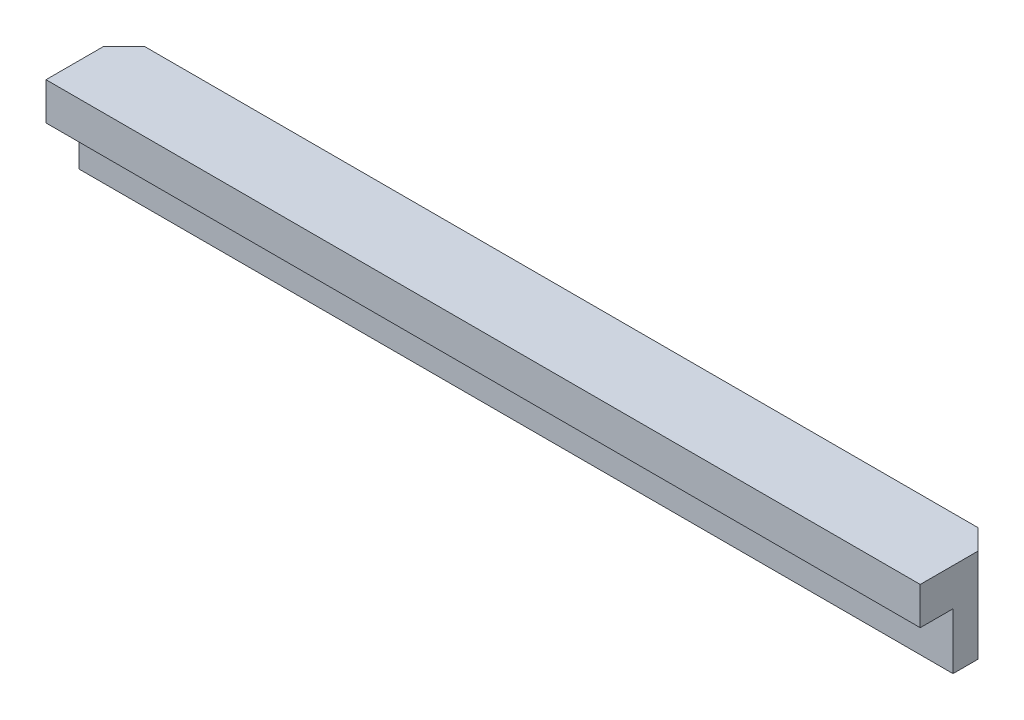
from build123d import *

# Parameters (mm, degrees)
SKETCH1_W           = 280
SKETCH1_H           = 25
BOSS_EXTRUDE1_DEPTH = 30
SKETCH2_W           = 10.5
SKETCH2_H           = 18
CUT_EXTRUDE1_DEPTH  = 300
CHAMFER1_SIZE       = 6.5


with BuildPart() as part:
    # Sketch1 → Boss-Extrude1 (new body)
    with BuildSketch(Plane(origin=(0, 0, 0), x_dir=(1, 0, 0), z_dir=(0, 1, 0))):
        Rectangle(SKETCH1_W, SKETCH1_H)
    extrude(amount=BOSS_EXTRUDE1_DEPTH)

    # Sketch2 → Cut-Extrude1 (cut)
    with BuildSketch(Plane(origin=(140, 0, 0), x_dir=(0, 0, -1), z_dir=(1, 0, 0))):
        with Locations((-7.25, 9)):
            Rectangle(SKETCH2_W, SKETCH2_H)
    extrude(amount=-CUT_EXTRUDE1_DEPTH, mode=Mode.SUBTRACT)

    # Chamfer1
    chamfer1_edges = [part.edges().sort_by_distance(p)[0] for p in [
        (-140, 15, -12.5),
        (140, 15, -12.5),
    ]]
    chamfer(chamfer1_edges, length=CHAMFER1_SIZE)


solid = part.part
